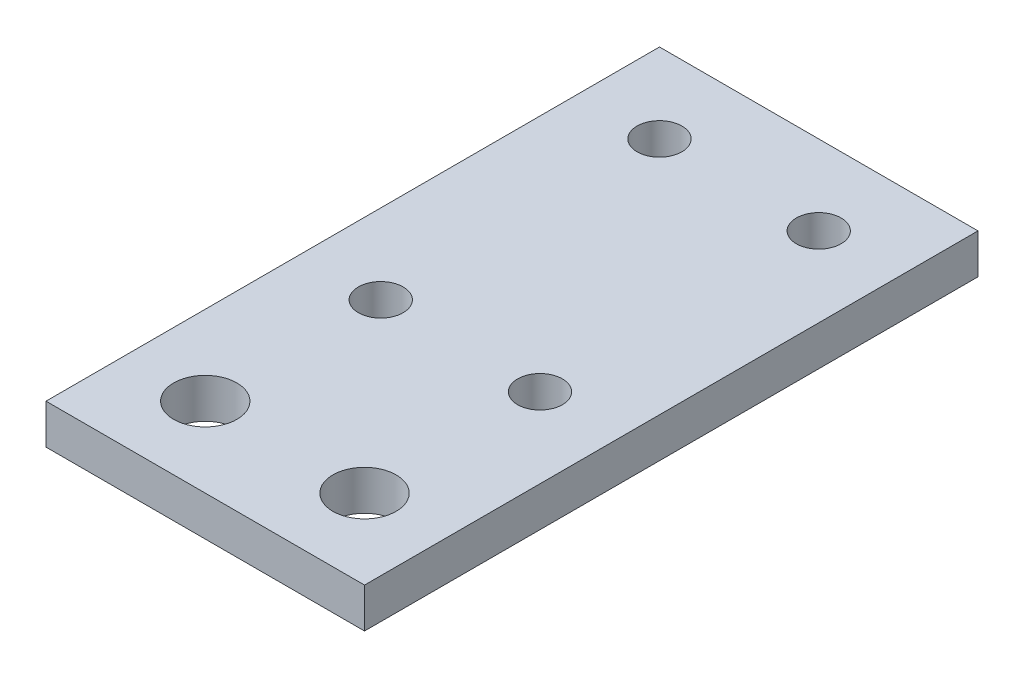
from build123d import *

# Parameters (mm, degrees)
SKETCH1_W                        = 50.8
SKETCH1_H                        = 6.35
EXTRUDE1_DEPTH                   = 97.8408
F_1_4_CLEARANCE_HOLE1_AT_2_COUNT = 2
F_1_4_CLEARANCE_HOLE1_AT_2_PITCH = 44.45


with BuildPart() as part:
    # Sketch1 → Extrude1 (new body)
    with BuildSketch(Plane.XY):
        Rectangle(SKETCH1_W, SKETCH1_H)
    extrude(amount=EXTRUDE1_DEPTH)

    # Sketch4 → 3/8 Clearance Hole1 (revolve, cut)
    with BuildSketch(Plane(origin=(12.7, 3.175, 85.1408), x_dir=(0, 0, 1), z_dir=(1, 0, 0))):
        Polygon((0, 0), (0, 19.031479155), (5.0419, 16.002), (5.0419, 0), align=None)
    f_3_8_clearance_hole1 = revolve(axis=Axis((12.7, 9.525, 85.1408), (0, -1, 0)), mode=Mode.SUBTRACT)

    # Sketch5 → 1/4 Clearance Hole1 (revolve, cut)
    with BuildSketch(Plane(origin=(12.7, 3.175, 57.15), x_dir=(0, 0, 1), z_dir=(1, 0, 0))):
        Polygon((0, 0), (0, 18.147817477), (3.57124, 16.002), (3.57124, 0), align=None)
    f_1_4_clearance_hole1 = revolve(axis=Axis((12.7, 9.525, 57.15), (0, -1, 0)), mode=Mode.SUBTRACT)

    # 1/4 Clearance Hole1 at 2: 1/4 Clearance Hole1 ×2
    with Locations(*[(0, 0, -i * F_1_4_CLEARANCE_HOLE1_AT_2_PITCH) for i in range(1, F_1_4_CLEARANCE_HOLE1_AT_2_COUNT)]):
        add(f_1_4_clearance_hole1, mode=Mode.SUBTRACT)

    # Mirror1: 3/8 Clearance Hole1, 1/4 Clearance Hole1 across plane
    add(f_3_8_clearance_hole1.mirror(Plane(origin=(0, 0, 0), x_dir=(0, 0, 1), z_dir=(1, 0, 0))), mode=Mode.SUBTRACT)
    add(f_1_4_clearance_hole1.mirror(Plane(origin=(0, 0, 0), x_dir=(0, 0, 1), z_dir=(1, 0, 0))), mode=Mode.SUBTRACT)

    # Mirror1 copy 1 sketch → Mirror1 copy 1 (revolve, cut)
    with BuildSketch(Plane(origin=(-12.7, 3.175, 12.7), x_dir=(0, 0, 1), z_dir=(-1, 0, 0))):
        Polygon((0, 0), (0, -18.147817477), (3.57124, -16.002), (3.57124, 0), align=None)
    revolve(axis=Axis((-12.7, 9.525, 12.7), (0, 1, 0)), mode=Mode.SUBTRACT)


solid = part.part
